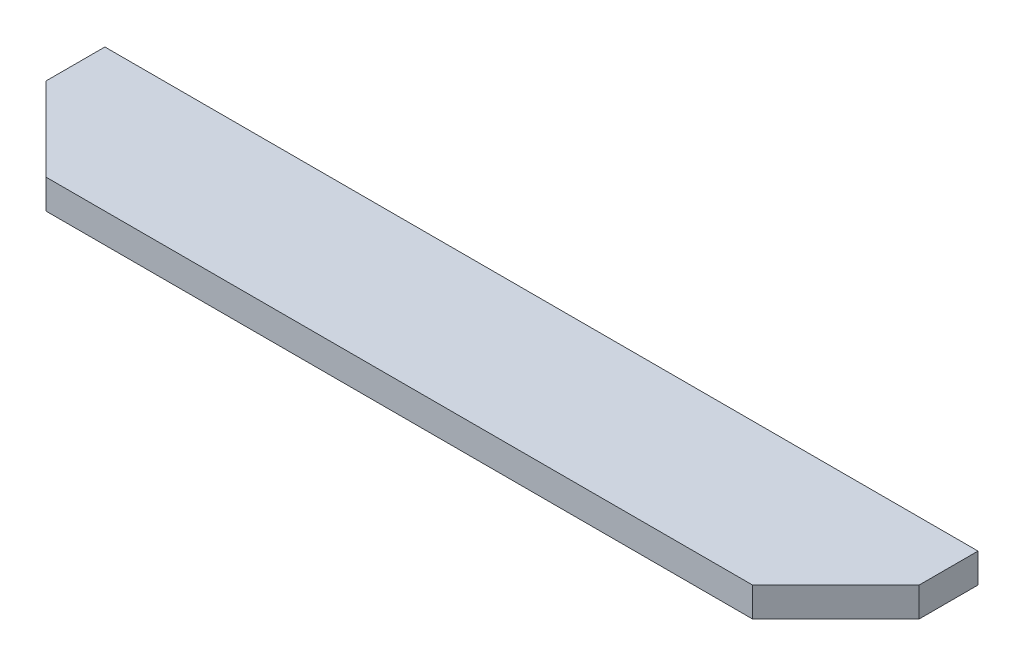
from build123d import *

# Parameters (mm, degrees)
BOSS_EXTRUDE1_DEPTH = 5


with BuildPart() as part:
    # Sketch2 → Boss-Extrude1 (new body)
    with BuildSketch(Plane(origin=(0, 0, 0), x_dir=(1, 0, 0), z_dir=(0, 1, 0))):
        Polygon((0, 0), (-120, 0), (-134.142135624, 14.142135624), (-134.142135624, 24.142135624), (14.142135624, 24.142135624), (14.142135624, 14.142135624), align=None)
    extrude(amount=BOSS_EXTRUDE1_DEPTH)


solid = part.part
